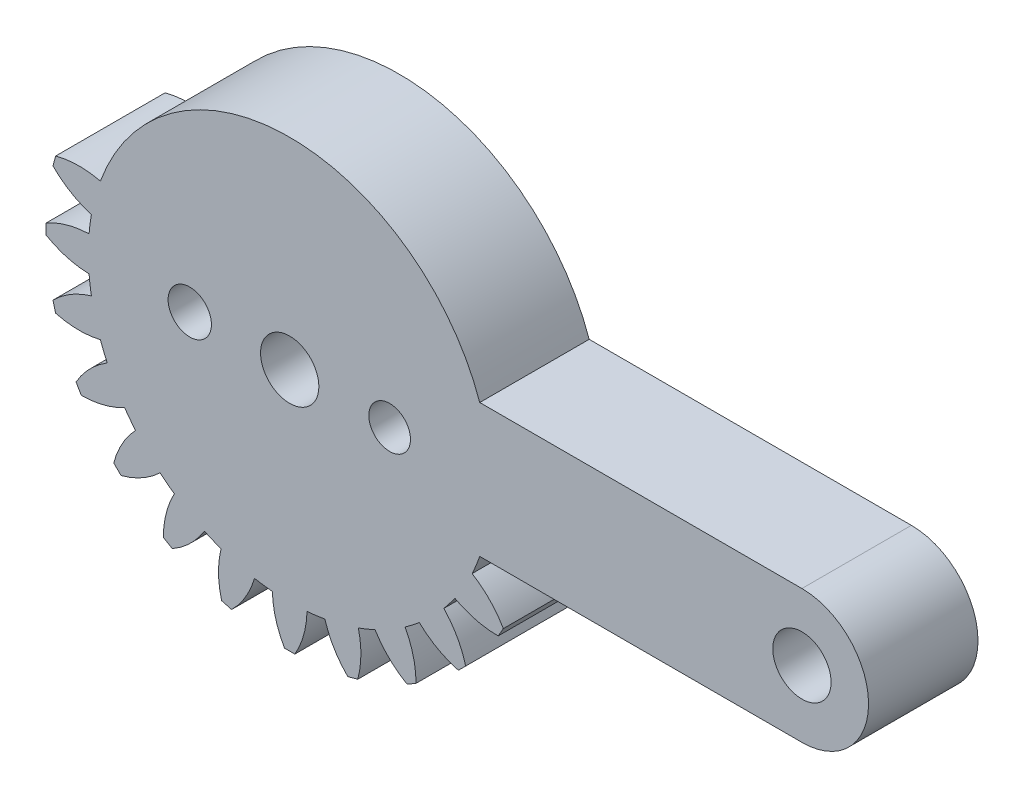
from build123d import *

# Parameters (mm, degrees)
SKETCH2_R           = 1.75
BOSS_EXTRUDE1_DEPTH = 12
SKETCH10_R          = 1.3
SKETCH10_R_2        = 1.25
CUT_EXTRUDE1_DEPTH  = 40.567655983
CUT_EXTRUDE2_START  = -4
CUT_EXTRUDE2_DEPTH  = 4
CUT_EXTRUDE3_DEPTH  = 0.57
CUT_EXTRUDE4_DEPTH  = 0.86


with BuildPart() as part:
    # Sketch2 → Boss-Extrude1 (new body)
    with BuildSketch(Plane.XY):
        with BuildLine():
            ThreePointArc((-11.365584201, 4.122086336), (-12.71070456, 4.273667417), (-14.051260935, 4.085959636))
            Line((-14.051260935, 4.085959636), (-14.211728743, 3.487085624))
            ThreePointArc((-14.211728743, 3.487085624), (-13.144626757, 2.65424773), (-11.903927815, 2.112960617))
            ThreePointArc((-11.903927815, 2.112960617), (-11.986568374, 1.578061664), (-12.04518576, 1.04))
            ThreePointArc((-12.04518576, 1.04), (-13.383704325, 0.838273314), (-14.63, 0.31))
            Line((-14.63, 0.31), (-14.63, -0.31))
            ThreePointArc((-14.63, -0.31), (-13.383704325, -0.838273314), (-12.04518576, -1.04))
            ThreePointArc((-12.04518576, -1.04), (-11.986568374, -1.578061664), (-11.903927815, -2.112960617))
            ThreePointArc((-11.903927815, -2.112960617), (-13.144626757, -2.65424773), (-14.211728743, -3.487085624))
            Line((-14.211728743, -3.487085624), (-14.051260935, -4.085959636))
            ThreePointArc((-14.051260935, -4.085959636), (-12.71070456, -4.273667417), (-11.365584201, -4.122086336))
            ThreePointArc((-11.365584201, -4.122086336), (-11.169703548, -4.626642697), (-10.951436862, -5.12192646))
            ThreePointArc((-10.951436862, -5.12192646), (-12.009764599, -5.965886177), (-12.824951657, -7.046532125))
            Line((-12.824951657, -7.046532125), (-12.514951657, -7.583467875))
            ThreePointArc((-12.514951657, -7.583467875), (-11.171491285, -7.417818147), (-9.911436862, -6.9232593))
            ThreePointArc((-9.911436862, -6.9232593), (-9.591641884, -7.359925677), (-9.252623584, -7.781841479))
            ThreePointArc((-9.252623584, -7.781841479), (-10.05645683, -8.870959341), (-10.564175311, -10.125769107))
            Line((-10.564175311, -10.125769107), (-10.125769107, -10.564175311))
            ThreePointArc((-10.125769107, -10.564175311), (-8.870959341, -10.05645683), (-7.781841479, -9.252623584))
            ThreePointArc((-7.781841479, -9.252623584), (-7.359925677, -9.591641884), (-6.9232593, -9.911436862))
            ThreePointArc((-6.9232593, -9.911436862), (-7.417818147, -11.171491285), (-7.583467875, -12.514951657))
            Line((-7.583467875, -12.514951657), (-7.046532125, -12.824951657))
            ThreePointArc((-7.046532125, -12.824951657), (-5.965886177, -12.009764599), (-5.12192646, -10.951436862))
            ThreePointArc((-5.12192646, -10.951436862), (-4.626642697, -11.169703548), (-4.122086336, -11.365584201))
            ThreePointArc((-4.122086336, -11.365584201), (-4.273667417, -12.71070456), (-4.085959636, -14.051260935))
            Line((-4.085959636, -14.051260935), (-3.487085624, -14.211728743))
            ThreePointArc((-3.487085624, -14.211728743), (-2.65424773, -13.144626757), (-2.112960617, -11.903927815))
            ThreePointArc((-2.112960617, -11.903927815), (-1.578061664, -11.986568374), (-1.04, -12.04518576))
            ThreePointArc((-1.04, -12.04518576), (-0.838273314, -13.383704325), (-0.31, -14.63))
            Line((-0.31, -14.63), (0.31, -14.63))
            ThreePointArc((0.31, -14.63), (0.838273314, -13.383704325), (1.04, -12.04518576))
            ThreePointArc((1.04, -12.04518576), (1.578061664, -11.986568374), (2.112960617, -11.903927815))
            ThreePointArc((2.112960617, -11.903927815), (2.65424773, -13.144626757), (3.487085624, -14.211728743))
            Line((3.487085624, -14.211728743), (4.085959636, -14.051260935))
            ThreePointArc((4.085959636, -14.051260935), (4.273667417, -12.71070456), (4.122086336, -11.365584201))
            ThreePointArc((4.122086336, -11.365584201), (4.626642697, -11.169703548), (5.12192646, -10.951436862))
            ThreePointArc((5.12192646, -10.951436862), (5.965886177, -12.009764599), (7.046532125, -12.824951657))
            Line((7.046532125, -12.824951657), (7.583467875, -12.514951657))
            ThreePointArc((7.583467875, -12.514951657), (7.417818147, -11.171491285), (6.9232593, -9.911436862))
            ThreePointArc((6.9232593, -9.911436862), (7.359925677, -9.591641884), (7.781841479, -9.252623584))
            ThreePointArc((7.781841479, -9.252623584), (8.870959341, -10.05645683), (10.125769107, -10.564175311))
            Line((10.125769107, -10.564175311), (10.564175311, -10.125769107))
            ThreePointArc((10.564175311, -10.125769107), (10.05645683, -8.870959341), (9.252623584, -7.781841479))
            ThreePointArc((9.252623584, -7.781841479), (9.591641884, -7.359925677), (9.911436862, -6.9232593))
            ThreePointArc((9.911436862, -6.9232593), (11.171491285, -7.417818147), (12.514951657, -7.583467875))
            Line((12.514951657, -7.583467875), (12.824951657, -7.046532125))
            ThreePointArc((12.824951657, -7.046532125), (12.009764599, -5.965886177), (10.951436862, -5.12192646))
            ThreePointArc((10.951436862, -5.12192646), (11.194344337, -4.566700654), (11.409123542, -4))
            Line((11.409123542, -4), (30.75, -4))
            ThreePointArc((30.75, -4), (34.75, 0), (30.75, 4))
            Line((30.75, 4), (11.409123542, 4))
            ThreePointArc((11.409123542, 4), (0.064808849, 12.089826294), (-11.365584201, 4.122086336))
        make_face()
        Circle(SKETCH2_R, mode=Mode.SUBTRACT)
        with Locations((30.75, 0)):
            Circle(SKETCH2_R, mode=Mode.SUBTRACT)
    extrude(amount=-BOSS_EXTRUDE1_DEPTH)

    # Sketch10 → Cut-Extrude1 (cut, through all)
    with BuildSketch(Plane(origin=(0, 0, -12), x_dir=(-1, 0, 0), z_dir=(0, 0, -1))):
        with Locations((6, 0)):
            Circle(SKETCH10_R)
        with Locations((-6, 0)):
            Circle(SKETCH10_R_2)
    extrude(amount=-CUT_EXTRUDE1_DEPTH, mode=Mode.SUBTRACT)

    # Sketch11 → Cut-Extrude2 (cut)
    with BuildSketch(Plane(origin=(0, 0, -12), x_dir=(-1, 0, 0), z_dir=(0, 0, -1)).offset(CUT_EXTRUDE2_START)):
        with BuildLine():
            Line((-11.409123542, 4), (-30.75, 4))
            ThreePointArc((-30.75, 4), (-34.75, 0), (-30.75, -4))
            Line((-30.75, -4), (-11.409123542, -4))
            ThreePointArc((-11.409123542, -4), (-11.194344337, -4.566700654), (-10.951436862, -5.12192646))
            ThreePointArc((-10.951436862, -5.12192646), (-12.009764599, -5.965886177), (-12.824951657, -7.046532125))
            Line((-12.824951657, -7.046532125), (-12.514951657, -7.583467875))
            ThreePointArc((-12.514951657, -7.583467875), (-11.171491285, -7.417818147), (-9.911436862, -6.9232593))
            ThreePointArc((-9.911436862, -6.9232593), (-9.591641884, -7.359925677), (-9.252623584, -7.781841479))
            ThreePointArc((-9.252623584, -7.781841479), (-10.05645683, -8.870959341), (-10.564175311, -10.125769107))
            Line((-10.564175311, -10.125769107), (-10.125769107, -10.564175311))
            ThreePointArc((-10.125769107, -10.564175311), (-8.870959341, -10.05645683), (-7.781841479, -9.252623584))
            ThreePointArc((-7.781841479, -9.252623584), (-7.359925677, -9.591641884), (-6.9232593, -9.911436862))
            ThreePointArc((-6.9232593, -9.911436862), (-7.417818147, -11.171491285), (-7.583467875, -12.514951657))
            Line((-7.583467875, -12.514951657), (-7.046532125, -12.824951657))
            ThreePointArc((-7.046532125, -12.824951657), (-5.965886177, -12.009764599), (-5.12192646, -10.951436862))
            ThreePointArc((-5.12192646, -10.951436862), (-4.626642697, -11.169703548), (-4.122086336, -11.365584201))
            ThreePointArc((-4.122086336, -11.365584201), (-4.273667417, -12.71070456), (-4.085959636, -14.051260935))
            Line((-4.085959636, -14.051260935), (-3.487085624, -14.211728743))
            ThreePointArc((-3.487085624, -14.211728743), (-2.65424773, -13.144626757), (-2.112960617, -11.903927815))
            ThreePointArc((-2.112960617, -11.903927815), (-1.578061664, -11.986568374), (-1.04, -12.04518576))
            ThreePointArc((-1.04, -12.04518576), (-0.838273314, -13.383704325), (-0.31, -14.63))
            Line((-0.31, -14.63), (0.31, -14.63))
            ThreePointArc((0.31, -14.63), (0.838273314, -13.383704325), (1.04, -12.04518576))
            ThreePointArc((1.04, -12.04518576), (1.578061664, -11.986568374), (2.112960617, -11.903927815))
            ThreePointArc((2.112960617, -11.903927815), (2.65424773, -13.144626757), (3.487085624, -14.211728743))
            Line((3.487085624, -14.211728743), (4.085959636, -14.051260935))
            ThreePointArc((4.085959636, -14.051260935), (4.273667417, -12.71070456), (4.122086336, -11.365584201))
            ThreePointArc((4.122086336, -11.365584201), (4.626642697, -11.169703548), (5.12192646, -10.951436862))
            ThreePointArc((5.12192646, -10.951436862), (5.965886177, -12.009764599), (7.046532125, -12.824951657))
            Line((7.046532125, -12.824951657), (7.583467875, -12.514951657))
            ThreePointArc((7.583467875, -12.514951657), (7.417818147, -11.171491285), (6.9232593, -9.911436862))
            ThreePointArc((6.9232593, -9.911436862), (7.359925677, -9.591641884), (7.781841479, -9.252623584))
            ThreePointArc((7.781841479, -9.252623584), (8.870959341, -10.05645683), (10.125769107, -10.564175311))
            Line((10.125769107, -10.564175311), (10.564175311, -10.125769107))
            ThreePointArc((10.564175311, -10.125769107), (10.05645683, -8.870959341), (9.252623584, -7.781841479))
            ThreePointArc((9.252623584, -7.781841479), (9.591641884, -7.359925677), (9.911436862, -6.9232593))
            ThreePointArc((9.911436862, -6.9232593), (11.171491285, -7.417818147), (12.514951657, -7.583467875))
            Line((12.514951657, -7.583467875), (12.824951657, -7.046532125))
            ThreePointArc((12.824951657, -7.046532125), (12.009764599, -5.965886177), (10.951436862, -5.12192646))
            ThreePointArc((10.951436862, -5.12192646), (11.169703548, -4.626642697), (11.365584201, -4.122086336))
            ThreePointArc((11.365584201, -4.122086336), (12.71070456, -4.273667417), (14.051260935, -4.085959636))
            Line((14.051260935, -4.085959636), (14.211728743, -3.487085624))
            ThreePointArc((14.211728743, -3.487085624), (13.144626757, -2.65424773), (11.903927815, -2.112960617))
            ThreePointArc((11.903927815, -2.112960617), (11.986568374, -1.578061664), (12.04518576, -1.04))
            ThreePointArc((12.04518576, -1.04), (13.383704325, -0.838273314), (14.63, -0.31))
            Line((14.63, -0.31), (14.63, 0.31))
            ThreePointArc((14.63, 0.31), (13.383704325, 0.838273314), (12.04518576, 1.04))
            ThreePointArc((12.04518576, 1.04), (11.986568374, 1.578061664), (11.903927815, 2.112960617))
            ThreePointArc((11.903927815, 2.112960617), (13.144626757, 2.65424773), (14.211728743, 3.487085624))
            Line((14.211728743, 3.487085624), (14.051260935, 4.085959636))
            ThreePointArc((14.051260935, 4.085959636), (12.71070456, 4.273667417), (11.365584201, 4.122086336))
            ThreePointArc((11.365584201, 4.122086336), (-0.064808849, 12.089826294), (-11.409123542, 4))
        make_face()
    extrude(amount=CUT_EXTRUDE2_DEPTH, mode=Mode.SUBTRACT)

    # Sketch12 → Cut-Extrude3 (cut)
    with BuildSketch(Plane.XY):
        with BuildLine():
            ThreePointArc((30.75, -4), (34.75, 0), (30.75, 4))
            Line((30.75, 4), (11.409123542, 4))
            ThreePointArc((11.409123542, 4), (0.064808849, 12.089826294), (-11.365584201, 4.122086336))
            ThreePointArc((-11.365584201, 4.122086336), (-12.71070456, 4.273667417), (-14.051260935, 4.085959636))
            Line((-14.051260935, 4.085959636), (-14.211728743, 3.487085624))
            ThreePointArc((-14.211728743, 3.487085624), (-13.144626757, 2.65424773), (-11.903927815, 2.112960617))
            ThreePointArc((-11.903927815, 2.112960617), (-11.986568374, 1.578061664), (-12.04518576, 1.04))
            ThreePointArc((-12.04518576, 1.04), (-13.383704325, 0.838273314), (-14.63, 0.31))
            Line((-14.63, 0.31), (-14.63, -0.31))
            ThreePointArc((-14.63, -0.31), (-13.383704325, -0.838273314), (-12.04518576, -1.04))
            ThreePointArc((-12.04518576, -1.04), (-11.986568374, -1.578061664), (-11.903927815, -2.112960617))
            ThreePointArc((-11.903927815, -2.112960617), (-13.144626757, -2.65424773), (-14.211728743, -3.487085624))
            Line((-14.211728743, -3.487085624), (-14.051260935, -4.085959636))
            ThreePointArc((-14.051260935, -4.085959636), (-12.71070456, -4.273667417), (-11.365584201, -4.122086336))
            ThreePointArc((-11.365584201, -4.122086336), (-11.169703548, -4.626642697), (-10.951436862, -5.12192646))
            ThreePointArc((-10.951436862, -5.12192646), (-12.009764599, -5.965886177), (-12.824951657, -7.046532125))
            Line((-12.824951657, -7.046532125), (-12.514951657, -7.583467875))
            ThreePointArc((-12.514951657, -7.583467875), (-11.171491285, -7.417818147), (-9.911436862, -6.9232593))
            ThreePointArc((-9.911436862, -6.9232593), (-9.591641884, -7.359925677), (-9.252623584, -7.781841479))
            ThreePointArc((-9.252623584, -7.781841479), (-10.05645683, -8.870959341), (-10.564175311, -10.125769107))
            Line((-10.564175311, -10.125769107), (-10.125769107, -10.564175311))
            ThreePointArc((-10.125769107, -10.564175311), (-8.870959341, -10.05645683), (-7.781841479, -9.252623584))
            ThreePointArc((-7.781841479, -9.252623584), (-7.359925677, -9.591641884), (-6.9232593, -9.911436862))
            ThreePointArc((-6.9232593, -9.911436862), (-7.417818147, -11.171491285), (-7.583467875, -12.514951657))
            Line((-7.583467875, -12.514951657), (-7.046532125, -12.824951657))
            ThreePointArc((-7.046532125, -12.824951657), (-5.965886177, -12.009764599), (-5.12192646, -10.951436862))
            ThreePointArc((-5.12192646, -10.951436862), (-4.626642697, -11.169703548), (-4.122086336, -11.365584201))
            ThreePointArc((-4.122086336, -11.365584201), (-4.273667417, -12.71070456), (-4.085959636, -14.051260935))
            Line((-4.085959636, -14.051260935), (-3.487085624, -14.211728743))
            ThreePointArc((-3.487085624, -14.211728743), (-2.65424773, -13.144626757), (-2.112960617, -11.903927815))
            ThreePointArc((-2.112960617, -11.903927815), (-1.578061664, -11.986568374), (-1.04, -12.04518576))
            ThreePointArc((-1.04, -12.04518576), (-0.838273314, -13.383704325), (-0.31, -14.63))
            Line((-0.31, -14.63), (0.31, -14.63))
            ThreePointArc((0.31, -14.63), (0.838273314, -13.383704325), (1.04, -12.04518576))
            ThreePointArc((1.04, -12.04518576), (1.578061664, -11.986568374), (2.112960617, -11.903927815))
            ThreePointArc((2.112960617, -11.903927815), (2.65424773, -13.144626757), (3.487085624, -14.211728743))
            Line((3.487085624, -14.211728743), (4.085959636, -14.051260935))
            ThreePointArc((4.085959636, -14.051260935), (4.273667417, -12.71070456), (4.122086336, -11.365584201))
            ThreePointArc((4.122086336, -11.365584201), (4.626642697, -11.169703548), (5.12192646, -10.951436862))
            ThreePointArc((5.12192646, -10.951436862), (5.965886177, -12.009764599), (7.046532125, -12.824951657))
            Line((7.046532125, -12.824951657), (7.583467875, -12.514951657))
            ThreePointArc((7.583467875, -12.514951657), (7.417818147, -11.171491285), (6.9232593, -9.911436862))
            ThreePointArc((6.9232593, -9.911436862), (7.359925677, -9.591641884), (7.781841479, -9.252623584))
            ThreePointArc((7.781841479, -9.252623584), (8.870959341, -10.05645683), (10.125769107, -10.564175311))
            Line((10.125769107, -10.564175311), (10.564175311, -10.125769107))
            ThreePointArc((10.564175311, -10.125769107), (10.05645683, -8.870959341), (9.252623584, -7.781841479))
            ThreePointArc((9.252623584, -7.781841479), (9.591641884, -7.359925677), (9.911436862, -6.9232593))
            ThreePointArc((9.911436862, -6.9232593), (11.171491285, -7.417818147), (12.514951657, -7.583467875))
            Line((12.514951657, -7.583467875), (12.824951657, -7.046532125))
            ThreePointArc((12.824951657, -7.046532125), (12.009764599, -5.965886177), (10.951436862, -5.12192646))
            ThreePointArc((10.951436862, -5.12192646), (11.194344337, -4.566700654), (11.409123542, -4))
            Line((11.409123542, -4), (30.75, -4))
        make_face()
    extrude(amount=-CUT_EXTRUDE3_DEPTH, mode=Mode.SUBTRACT)

    # Sketch16 → Cut-Extrude4 (cut)
    with BuildSketch(Plane.XY.offset(-0.57)):
        with BuildLine():
            Line((11.409123542, -4), (30.75, -4))
            ThreePointArc((30.75, -4), (34.75, 0), (30.75, 4))
            Line((30.75, 4), (11.409123542, 4))
            ThreePointArc((11.409123542, 4), (0.064808849, 12.089826294), (-11.365584201, 4.122086336))
            ThreePointArc((-11.365584201, 4.122086336), (-12.71070456, 4.273667417), (-14.051260935, 4.085959636))
            Line((-14.051260935, 4.085959636), (-14.211728743, 3.487085624))
            ThreePointArc((-14.211728743, 3.487085624), (-13.144626757, 2.65424773), (-11.903927815, 2.112960617))
            ThreePointArc((-11.903927815, 2.112960617), (-11.986568374, 1.578061664), (-12.04518576, 1.04))
            ThreePointArc((-12.04518576, 1.04), (-13.383704325, 0.838273314), (-14.63, 0.31))
            Line((-14.63, 0.31), (-14.63, -0.31))
            ThreePointArc((-14.63, -0.31), (-13.383704325, -0.838273314), (-12.04518576, -1.04))
            ThreePointArc((-12.04518576, -1.04), (-11.986568374, -1.578061664), (-11.903927815, -2.112960617))
            ThreePointArc((-11.903927815, -2.112960617), (-13.144626757, -2.65424773), (-14.211728743, -3.487085624))
            Line((-14.211728743, -3.487085624), (-14.051260935, -4.085959636))
            ThreePointArc((-14.051260935, -4.085959636), (-12.71070456, -4.273667417), (-11.365584201, -4.122086336))
            ThreePointArc((-11.365584201, -4.122086336), (-11.169703548, -4.626642697), (-10.951436862, -5.12192646))
            ThreePointArc((-10.951436862, -5.12192646), (-12.009764599, -5.965886177), (-12.824951657, -7.046532125))
            Line((-12.824951657, -7.046532125), (-12.514951657, -7.583467875))
            ThreePointArc((-12.514951657, -7.583467875), (-11.171491285, -7.417818147), (-9.911436862, -6.9232593))
            ThreePointArc((-9.911436862, -6.9232593), (-9.591641884, -7.359925677), (-9.252623584, -7.781841479))
            ThreePointArc((-9.252623584, -7.781841479), (-10.05645683, -8.870959341), (-10.564175311, -10.125769107))
            Line((-10.564175311, -10.125769107), (-10.125769107, -10.564175311))
            ThreePointArc((-10.125769107, -10.564175311), (-8.870959341, -10.05645683), (-7.781841479, -9.252623584))
            ThreePointArc((-7.781841479, -9.252623584), (-7.359925677, -9.591641884), (-6.9232593, -9.911436862))
            ThreePointArc((-6.9232593, -9.911436862), (-7.417818147, -11.171491285), (-7.583467875, -12.514951657))
            Line((-7.583467875, -12.514951657), (-7.046532125, -12.824951657))
            ThreePointArc((-7.046532125, -12.824951657), (-5.965886177, -12.009764599), (-5.12192646, -10.951436862))
            ThreePointArc((-5.12192646, -10.951436862), (-4.626642697, -11.169703548), (-4.122086336, -11.365584201))
            ThreePointArc((-4.122086336, -11.365584201), (-4.273667417, -12.71070456), (-4.085959636, -14.051260935))
            Line((-4.085959636, -14.051260935), (-3.487085624, -14.211728743))
            ThreePointArc((-3.487085624, -14.211728743), (-2.65424773, -13.144626757), (-2.112960617, -11.903927815))
            ThreePointArc((-2.112960617, -11.903927815), (-1.578061664, -11.986568374), (-1.04, -12.04518576))
            ThreePointArc((-1.04, -12.04518576), (-0.838273314, -13.383704325), (-0.31, -14.63))
            Line((-0.31, -14.63), (0.31, -14.63))
            ThreePointArc((0.31, -14.63), (0.838273314, -13.383704325), (1.04, -12.04518576))
            ThreePointArc((1.04, -12.04518576), (1.578061664, -11.986568374), (2.112960617, -11.903927815))
            ThreePointArc((2.112960617, -11.903927815), (2.65424773, -13.144626757), (3.487085624, -14.211728743))
            Line((3.487085624, -14.211728743), (4.085959636, -14.051260935))
            ThreePointArc((4.085959636, -14.051260935), (4.273667417, -12.71070456), (4.122086336, -11.365584201))
            ThreePointArc((4.122086336, -11.365584201), (4.626642697, -11.169703548), (5.12192646, -10.951436862))
            ThreePointArc((5.12192646, -10.951436862), (5.965886177, -12.009764599), (7.046532125, -12.824951657))
            Line((7.046532125, -12.824951657), (7.583467875, -12.514951657))
            ThreePointArc((7.583467875, -12.514951657), (7.417818147, -11.171491285), (6.9232593, -9.911436862))
            ThreePointArc((6.9232593, -9.911436862), (7.359925677, -9.591641884), (7.781841479, -9.252623584))
            ThreePointArc((7.781841479, -9.252623584), (8.870959341, -10.05645683), (10.125769107, -10.564175311))
            Line((10.125769107, -10.564175311), (10.564175311, -10.125769107))
            ThreePointArc((10.564175311, -10.125769107), (10.05645683, -8.870959341), (9.252623584, -7.781841479))
            ThreePointArc((9.252623584, -7.781841479), (9.591641884, -7.359925677), (9.911436862, -6.9232593))
            ThreePointArc((9.911436862, -6.9232593), (11.171491285, -7.417818147), (12.514951657, -7.583467875))
            Line((12.514951657, -7.583467875), (12.824951657, -7.046532125))
            ThreePointArc((12.824951657, -7.046532125), (12.009764599, -5.965886177), (10.951436862, -5.12192646))
            ThreePointArc((10.951436862, -5.12192646), (11.194344337, -4.566700654), (11.409123542, -4))
        make_face()
    extrude(amount=-CUT_EXTRUDE4_DEPTH, mode=Mode.SUBTRACT)


solid = part.part
